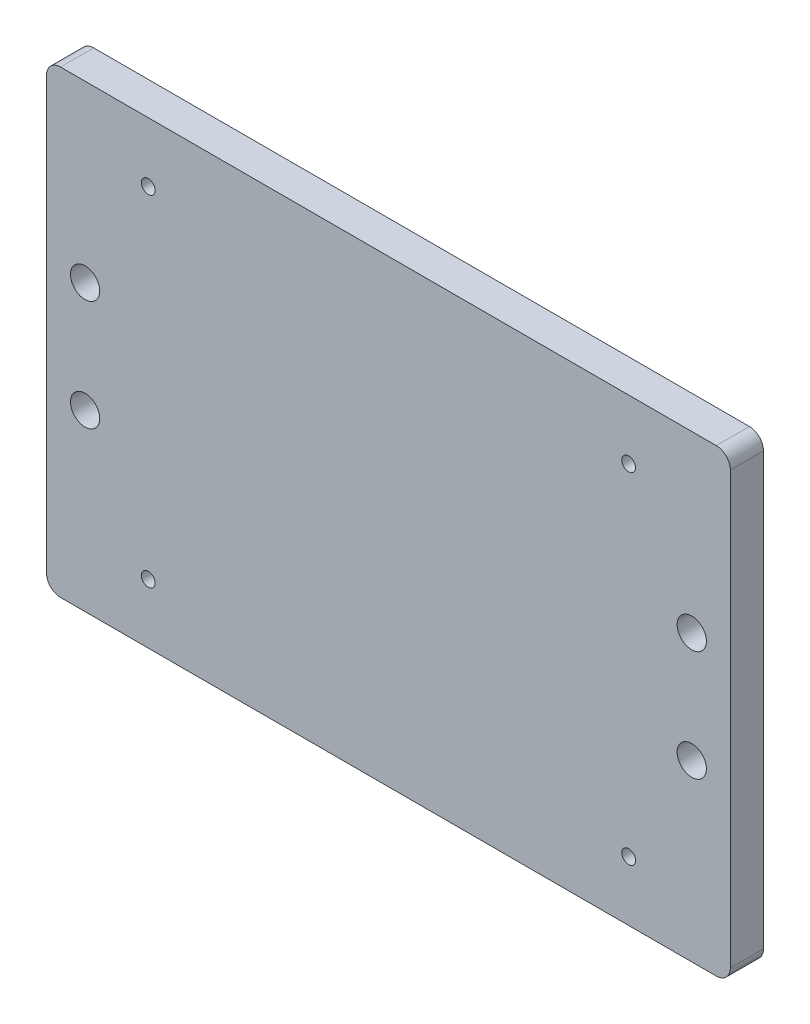
from build123d import *

# Parameters (mm, degrees)
BOSS_EXTRUDE1_DEPTH   = 6
M5_CLEARANCE_HOLE1_D  = 5.3
M3X0_5_TAPPED_HOLE1_D = 2.5


with BuildPart() as part:
    # Sketch1 → Boss-Extrude1 (new body)
    with BuildSketch(Plane(origin=(0, 0, -11.999999876), x_dir=(-1, 0, 0), z_dir=(0, 0, -1))):
        with BuildLine():
            Line((-493.014, 385.953), (-374.269, 385.953))
            ThreePointArc((-374.269, 385.953), (-372.472948776, 385.209051224), (-371.729, 383.413))
            Line((-371.729, 383.413), (-371.729, 305.308))
            ThreePointArc((-371.729, 305.308), (-372.472948776, 303.511948776), (-374.269, 302.768))
            Line((-374.269, 302.768), (-493.014, 302.768))
            ThreePointArc((-493.014, 302.768), (-494.810051224, 303.511948776), (-495.554, 305.308))
            Line((-495.554, 305.308), (-495.554, 383.413))
            ThreePointArc((-495.554, 383.413), (-494.810051224, 385.209051224), (-493.014, 385.953))
        make_face()
    extrude(amount=BOSS_EXTRUDE1_DEPTH)

    # M5 Clearance Hole1 (through all)
    with Locations(Plane(origin=(0, 0, -17.999999876), x_dir=(-1, 0, 0), z_dir=(0, 0, -1))):
        with Locations((-488.569, 354.360499939), (-488.569, 334.360500061), (-378.714, 334.360500061), (-378.714, 354.360499939)):
            Hole(M5_CLEARANCE_HOLE1_D / 2)

    # M3x0.5 Tapped Hole1 (through all)
    with Locations(Plane(origin=(0, 0, -17.999999876), x_dir=(-1, 0, 0), z_dir=(0, 0, -1))):
        with Locations((-477.139, 375.158), (-390.144, 375.158), (-390.144, 313.563), (-477.139, 313.563)):
            Hole(M3X0_5_TAPPED_HOLE1_D / 2)


solid = part.part
